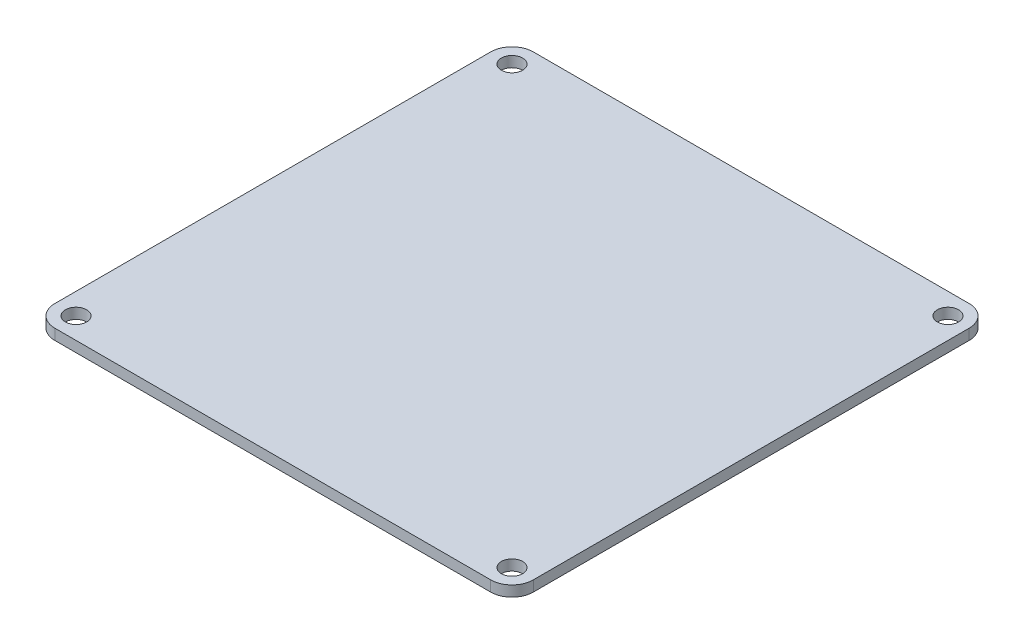
from build123d import *

# Parameters (mm, degrees)
BASE_PLATE_DEPTH = 100
SKETCH3_R        = 100
BASE_HOLES_DEPTH = 100


with BuildPart() as part:
    # Sketch2 → Base plate (new body)
    with BuildSketch(Plane(origin=(0, 0, 0), x_dir=(1, 0, 0), z_dir=(0, 1, 0))):
        with BuildLine():
            Line((-2050, -2250), (2050, -2250))
            ThreePointArc((2050, -2250), (2191.421356237, -2191.421356237), (2250, -2050))
            Line((2250, -2050), (2250, 2050))
            ThreePointArc((2250, 2050), (2191.421356237, 2191.421356237), (2050, 2250))
            Line((2050, 2250), (-2050, 2250))
            ThreePointArc((-2050, 2250), (-2191.421356237, 2191.421356237), (-2250, 2050))
            Line((-2250, 2050), (-2250, -2050))
            ThreePointArc((-2250, -2050), (-2191.421356237, -2191.421356237), (-2050, -2250))
        make_face()
    extrude(amount=BASE_PLATE_DEPTH)

    # Sketch3 → base holes (cut)
    with BuildSketch(Plane(origin=(0, 100, 0), x_dir=(1, 0, 0), z_dir=(0, 1, 0))):
        with Locations(Location((-2050, 2050, 0), (0, 0, 270))):
            Circle(SKETCH3_R)
        with Locations(Location((-2050, -2050, 0), (0, 0, 90))):
            Circle(SKETCH3_R)
        with Locations(Location((2050, -2050, 0), (0, 0, 270))):
            Circle(SKETCH3_R)
        with Locations(Location((2050, 2050, 0), (0, 0, 90))):
            Circle(SKETCH3_R)
    extrude(amount=-BASE_HOLES_DEPTH, mode=Mode.SUBTRACT)


solid = part.part
